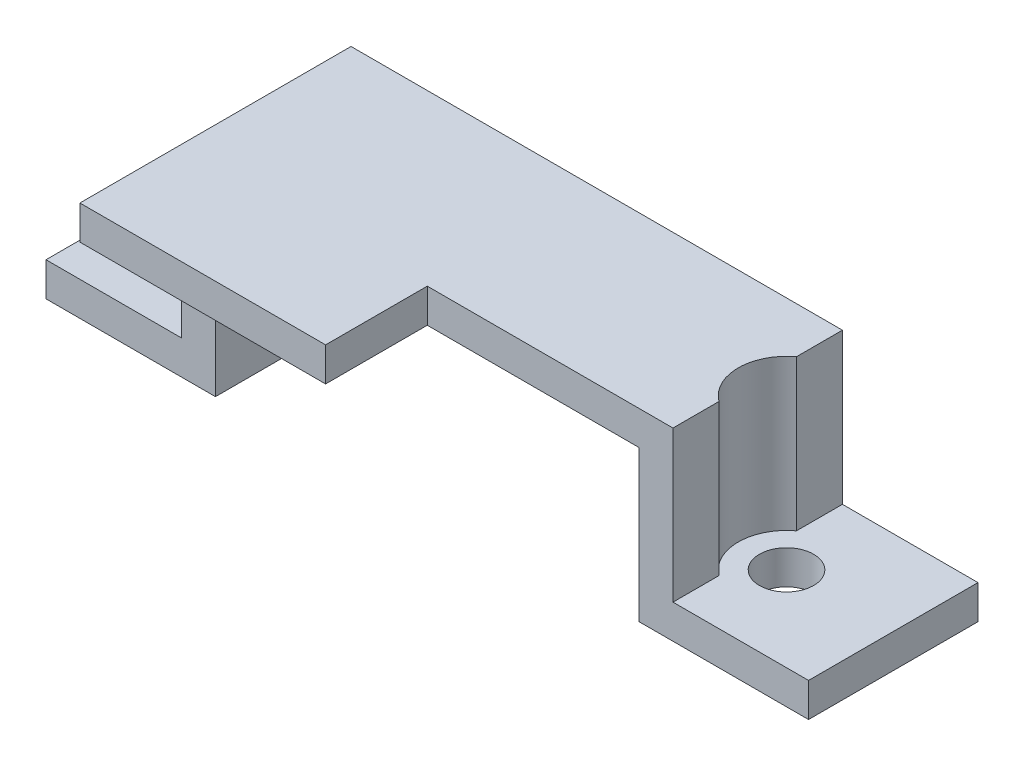
from build123d import *

# Parameters (mm, degrees)
MOUNT_DEPTH            = 10
IZIM5_W                = 14.5
IZIM5_H                = 2
MOTOR_ST_DEPTH         = 6
C_VATA_START           = -2
IZIM6_R                = 1.6
C_VATA_DELIKLERI_DEPTH = 6
IZIM7_R                = 2.85
KES_EKSTR_ZYON1_DEPTH  = 8.9


with BuildPart() as part:
    # Çizim4 → mount (new body)
    with BuildSketch(Plane.XY):
        Polygon((-22, 2.1), (-14, 2.1), (-14, 12), (15, 12), (15, 3.1), (23, 3.1), (23, 1.1), (13, 1.1), (13, 10), (-12, 10), (-12, 0.1), (-22, 0.1), align=None)
    extrude(amount=MOUNT_DEPTH)

    # Çizim5 → motor üstü (add)
    with BuildSketch(Plane.XY.offset(10)):
        with Locations((-6.75, 11)):
            Rectangle(IZIM5_W, IZIM5_H)
    extrude(amount=MOTOR_ST_DEPTH)

    # Çizim6 → cıvata delikleri (cut)
    with BuildSketch(Plane(origin=(0, 2.1, 0), x_dir=(1, 0, 0), z_dir=(0, 1, 0)).offset(C_VATA_START)):
        with Locations(Location((-18, -5, 0), (0, 0, 270))):
            Circle(IZIM6_R)
        with Locations(Location((16.7, -5, 0), (0, 0, 180))):
            Circle(IZIM6_R)
    extrude(amount=C_VATA_DELIKLERI_DEPTH, mode=Mode.SUBTRACT)

    # Çizim7 → Kes-Ekstrüzyon1 (cut)
    with BuildSketch(Plane(origin=(0, 3.1, 0), x_dir=(1, 0, 0), z_dir=(0, 1, 0))):
        with Locations((16.7, -5)):
            Circle(IZIM7_R)
    extrude(amount=KES_EKSTR_ZYON1_DEPTH, mode=Mode.SUBTRACT)


solid = part.part
